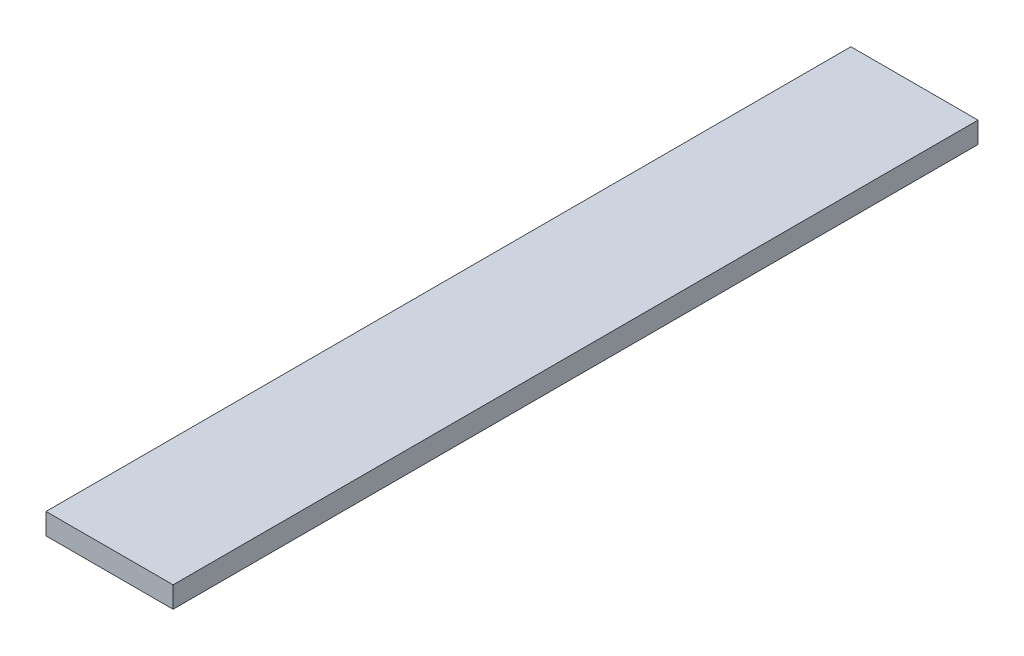
from build123d import *

# Parameters (mm, degrees)
SKETCH1_W           = 38.1
SKETCH1_H           = 6.35
BOSS_EXTRUDE1_DEPTH = 241.3


with BuildPart() as part:
    # Sketch1 → Boss-Extrude1 (new body)
    with BuildSketch(Plane.XY):
        Rectangle(SKETCH1_W, SKETCH1_H)
    extrude(amount=BOSS_EXTRUDE1_DEPTH)


solid = part.part
